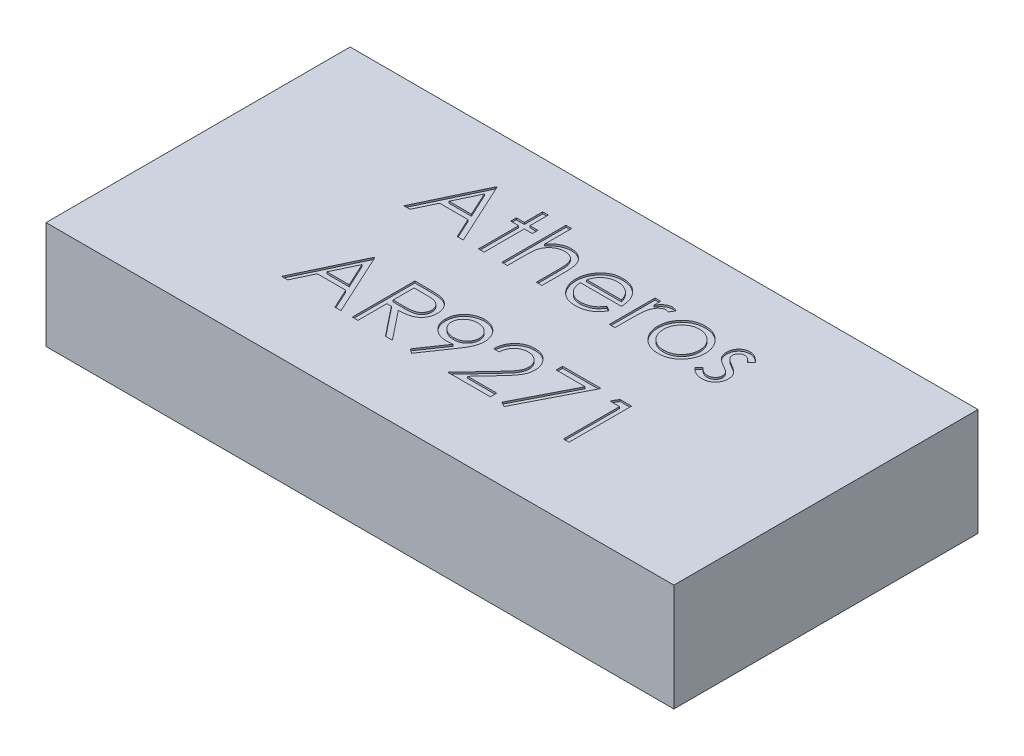
from build123d import *

# Parameters (mm, degrees)
SKETCH1_W           = 35.1
SKETCH1_H           = 17
BOSS_EXTRUDE1_DEPTH = 6
CUT_EXTRUDE1_DEPTH  = 0.1


with BuildPart() as part:
    # Sketch1 → Boss-Extrude1 (new body)
    with BuildSketch(Plane(origin=(0, 0, 0), x_dir=(1, 0, 0), z_dir=(0, 1, 0))):
        with Locations((17.55, 8.5)):
            Rectangle(SKETCH1_W, SKETCH1_H)
    extrude(amount=BOSS_EXTRUDE1_DEPTH)

    # Sketch2 → Cut-Extrude1 (cut)
    # profile 1 of 13: a face of its own
    with BuildSketch(Plane(origin=(0, 6, 0), x_dir=(1, 0, 0), z_dir=(0, 1, 0))):
        Polygon((10.894419489, 14.316811655), (12.509804105, 10.816811655), (12.168357791, 10.816811655), (11.650929906, 11.938606527), (10.064291284, 11.938606527), (9.532139842, 10.816811655), (9.189291284, 10.816811655), (10.849547694, 14.316811655), align=None)
        Polygon((10.868477983, 13.634620149), (10.23466388, 12.297580886), (11.485465162, 12.297580886), align=None, mode=Mode.SUBTRACT)
    # profile 2 of 13: a face of its own
    with BuildSketch(Plane(origin=(0, 6, 0), x_dir=(1, 0, 0), z_dir=(0, 1, 0))):
        Polygon((13.362368207, 14.406555245), (13.676470771, 14.406555245), (13.676470771, 13.374503963), (14.12518872, 13.374503963), (14.12518872, 13.060401399), (13.676470771, 13.060401399), (13.676470771, 10.816811655), (13.362368207, 10.816811655), (13.362368207, 13.060401399), (12.913650258, 13.060401399), (12.913650258, 13.374503963), (13.362368207, 13.374503963), align=None)
    # profile 3 of 13: a face of its own
    with BuildSketch(Plane(origin=(0, 6, 0), x_dir=(1, 0, 0), z_dir=(0, 1, 0))):
        with BuildLine():
            Line((14.663650258, 14.406555245), (14.977752823, 14.406555245))
            Line((14.977752823, 14.406555245), (14.977752823, 12.891431046))
            add(Edge.make_bspline(
                [(14.977752823, 12.891431046), (15.011470124, 12.933575028), (15.077119438, 13.015631521), (15.187615555, 13.122692712), (15.301086427, 13.215491333), (15.421451237, 13.28936179), (15.546501757, 13.347718333), (15.676765402, 13.38910598), (15.812266373, 13.414557076), (15.904291523, 13.417755494), (15.950909874, 13.419375757)],
                knots=[0, 0, 0, 0, 1.125788106, 2.19196713, 3.20547328, 4.180437432, 5.132270164, 6.079753143, 7.027236121, 8, 8, 8, 8], degree=3))
            add(Edge.make_bspline(
                [(15.950909874, 13.419375757), (15.998240267, 13.417630327), (16.090877262, 13.414214099), (16.225758725, 13.387200718), (16.3517196, 13.34104328), (16.468385443, 13.277876255), (16.57321014, 13.199203428), (16.666059904, 13.108371905), (16.741900703, 13.003097987), (16.79349982, 12.905841733), (16.827073228, 12.819302979), (16.848325054, 12.745066467), (16.866344252, 12.662344554), (16.882043988, 12.571179821), (16.89250757, 12.47113465), (16.900912188, 12.362660395), (16.906888642, 12.245763277), (16.907120246, 12.164843028), (16.907240002, 12.123001559)],
                knots=[0, 0, 0, 0, 1.235656852, 2.418478516, 3.575258207, 4.727955599, 5.870717718, 6.98870536, 8.107142894, 9.245821548, 9.854588956, 10.528768408, 11.260415777, 12.065282286, 12.943670737, 13.886611085, 14.907229059, 16, 16, 16, 16], degree=3))
            Line((16.907240002, 12.123001559), (16.907240002, 10.816811655))
            Line((16.907240002, 10.816811655), (16.593137438, 10.816811655))
            Line((16.593137438, 10.816811655), (16.593137438, 12.019936655))
            add(Edge.make_bspline(
                [(16.593137438, 12.019936655), (16.592947135, 12.054759324), (16.592583117, 12.121369165), (16.591379773, 12.216735273), (16.588693557, 12.303231408), (16.584352732, 12.38058036), (16.579787424, 12.448889963), (16.573504107, 12.508061017), (16.566193873, 12.558174793), (16.559625091, 12.588339421), (16.556679105, 12.601867745)],
                knots=[0, 0, 0, 0, 1.430932559, 2.737130458, 3.918967929, 4.986496826, 5.920444988, 6.731744033, 7.431208747, 8, 8, 8, 8], degree=3))
            add(Edge.make_bspline(
                [(16.556679105, 12.601867745), (16.54525486, 12.641562008), (16.523291815, 12.717873999), (16.472243838, 12.821536409), (16.408484827, 12.90992115), (16.330637565, 12.981835438), (16.240079201, 13.038246977), (16.136219237, 13.07731476), (16.020035168, 13.101562481), (15.938183697, 13.104001785), (15.895521252, 13.105273193)],
                knots=[0, 0, 0, 0, 1.090059168, 2.095632401, 3.037101401, 3.955032261, 4.878929692, 5.839099886, 6.873700383, 8, 8, 8, 8], degree=3))
            add(Edge.make_bspline(
                [(15.895521252, 13.105273193), (15.870253479, 13.104797367), (15.820249209, 13.103855719), (15.746100543, 13.094401821), (15.674171479, 13.078953102), (15.603769301, 13.058048563), (15.536386104, 13.029603027), (15.470057779, 12.996672837), (15.40666357, 12.956364582), (15.345077753, 12.911138815), (15.28776022, 12.861069055), (15.234433104, 12.8082221), (15.186894764, 12.751947136), (15.143826173, 12.69314702), (15.106647887, 12.631015227), (15.074194805, 12.566150908), (15.046659109, 12.498468762), (15.032976417, 12.451493701), (15.026130226, 12.42798954)],
                knots=[0, 0, 0, 0, 1.024319606, 2.027102035, 3.025350316, 4.005802111, 5.00026367, 5.987881639, 7.005602596, 8.042517216, 9.083927026, 10.089214625, 11.084353441, 12.06828073, 13.041928858, 14.016821737, 15.00770877, 16, 16, 16, 16], degree=3))
            add(Edge.make_bspline(
                [(15.026130226, 12.42798954), (15.022190799, 12.410968589), (15.013606302, 12.373877842), (15.004291469, 12.312703518), (14.995953672, 12.241617146), (14.988905123, 12.160726545), (14.984582036, 12.069735303), (14.979923796, 11.969264344), (14.978189782, 11.858684323), (14.977902829, 11.781788816), (14.977752823, 11.741591302)],
                knots=[0, 0, 0, 0, 0.607992626, 1.324890765, 2.152360218, 3.099583803, 4.150613268, 5.323148443, 6.60066238, 8, 8, 8, 8], degree=3))
            Line((14.977752823, 11.741591302), (14.977752823, 10.816811655))
            Line((14.977752823, 10.816811655), (14.663650258, 10.816811655))
            Line((14.663650258, 10.816811655), (14.663650258, 14.406555245))
        make_face()
    # profile 4 of 13: a face of its own
    with BuildSketch(Plane(origin=(0, 6, 0), x_dir=(1, 0, 0), z_dir=(0, 1, 0))):
        with BuildLine():
            Line((19.724347374, 11.624503963), (20.003393848, 11.477969507))
            add(Edge.make_bspline(
                [(20.003393848, 11.477969507), (19.981157253, 11.438526176), (19.937893645, 11.361785073), (19.863492897, 11.256353213), (19.785500824, 11.161505497), (19.700396856, 11.079775843), (19.610727177, 11.008524458), (19.515994522, 10.946186633), (19.415705705, 10.893068113), (19.30985598, 10.848315585), (19.197556429, 10.813906091), (19.078534912, 10.78960187), (18.952563417, 10.774578601), (18.866217237, 10.77283346), (18.822003624, 10.77193986)],
                knots=[0, 0, 0, 0, 1.120438281, 2.179929193, 3.190490725, 4.156257408, 5.095198341, 6.022838206, 6.959905092, 7.901321166, 8.864066838, 9.862729781, 10.905609505, 12, 12, 12, 12], degree=3))
            add(Edge.make_bspline(
                [(18.822003624, 10.77193986), (18.772861646, 10.773087035), (18.676999885, 10.775324842), (18.537460138, 10.794617307), (18.406080719, 10.826089665), (18.282869016, 10.870055207), (18.168126763, 10.927482531), (18.061625908, 10.997442013), (17.962806383, 11.079574267), (17.874782173, 11.174590711), (17.795538291, 11.276272668), (17.725612471, 11.382228553), (17.66715504, 11.492191777), (17.619602429, 11.605462301), (17.581197564, 11.721326195), (17.554430861, 11.840837662), (17.539001113, 11.963673246), (17.536636667, 12.046770582), (17.53544513, 12.088646591)],
                knots=[0, 0, 0, 0, 1.145258523, 2.234067595, 3.276747158, 4.290159414, 5.277019952, 6.260822364, 7.254936242, 8.264827045, 9.274100331, 10.257902744, 11.220704747, 12.172965371, 13.118907548, 14.062713208, 15.023725156, 16, 16, 16, 16], degree=3))
            add(Edge.make_bspline(
                [(17.53544513, 12.088646591), (17.536504272, 12.127941421), (17.53860335, 12.205818586), (17.551834137, 12.32108413), (17.57528243, 12.433112583), (17.607458754, 12.541997031), (17.64901, 12.647555165), (17.69984222, 12.749851229), (17.760034597, 12.848776368), (17.806507271, 12.911179502), (17.829916284, 12.942612937)],
                knots=[0, 0, 0, 0, 1.024358464, 2.0301432, 3.019427413, 4.004406732, 4.986367066, 5.972626655, 6.978780325, 8, 8, 8, 8], degree=3))
            add(Edge.make_bspline(
                [(17.829916284, 12.942612937), (17.861623967, 12.980481807), (17.924034914, 13.055019958), (18.029591269, 13.152958283), (18.143891465, 13.235002058), (18.265503091, 13.303009195), (18.395839565, 13.354682842), (18.533148856, 13.393190424), (18.678994443, 13.414768435), (18.778699663, 13.417816269), (18.829715964, 13.419375757)],
                knots=[0, 0, 0, 0, 1.030682036, 2.02871468, 2.997146059, 3.962720338, 4.930598197, 5.918074684, 6.934738563, 8, 8, 8, 8], degree=3))
            add(Edge.make_bspline(
                [(18.829715964, 13.419375757), (18.882163569, 13.418021709), (18.985053815, 13.415365373), (19.135085936, 13.39073904), (19.277046652, 13.351686485), (19.410879157, 13.296532695), (19.536597017, 13.225373143), (19.653383067, 13.137231302), (19.76323458, 13.034813214), (19.827143158, 12.956050005), (19.85966388, 12.915970309)],
                knots=[0, 0, 0, 0, 1.056321875, 2.072262726, 3.055038591, 4.01806755, 4.982017516, 5.957941055, 6.960871419, 8, 8, 8, 8], degree=3))
            add(Edge.make_bspline(
                [(19.85966388, 12.915970309), (19.881790819, 12.885766727), (19.925897412, 12.825560609), (19.981144512, 12.727389452), (20.029101907, 12.624678857), (20.067434868, 12.51576856), (20.098474369, 12.40194898), (20.120931188, 12.282406435), (20.134100806, 12.157176524), (20.136689504, 12.071849968), (20.138009233, 12.028350116)],
                knots=[0, 0, 0, 0, 0.94817472, 1.890038105, 2.849395472, 3.817997239, 4.812318967, 5.836947057, 6.897266129, 8, 8, 8, 8], degree=3))
            Line((20.138009233, 12.028350116), (17.849547694, 12.028350116))
            add(Edge.make_bspline(
                [(17.849547694, 12.028350116), (17.851087301, 11.994649652), (17.854114875, 11.928379048), (17.868230018, 11.831408265), (17.890478792, 11.739034923), (17.921747854, 11.651951881), (17.9596147, 11.569021754), (18.006000416, 11.490859717), (18.06133997, 11.417821787), (18.12306567, 11.349254649), (18.191772765, 11.288193888), (18.264055512, 11.233542112), (18.340949077, 11.187736515), (18.421847161, 11.150556625), (18.506618946, 11.121450309), (18.595291141, 11.101582489), (18.687689257, 11.088275382), (18.750674991, 11.086795716), (18.782740803, 11.086042424)],
                knots=[0, 0, 0, 0, 1.094153842, 2.151609401, 3.174256925, 4.172055639, 5.149267565, 6.128595816, 7.11444997, 8.118368179, 9.117203808, 10.09244225, 11.054858984, 12.015122123, 12.976791628, 13.957293641, 14.960065497, 16, 16, 16, 16], degree=3))
            add(Edge.make_bspline(
                [(18.782740803, 11.086042424), (18.814091951, 11.086650481), (18.876298642, 11.087856982), (18.968939499, 11.099588893), (19.060079027, 11.118559168), (19.14934001, 11.144449158), (19.234910856, 11.176026011), (19.314156406, 11.214128868), (19.387036621, 11.256278615), (19.455153588, 11.30448829), (19.521224581, 11.363496477), (19.586767068, 11.437132198), (19.657043721, 11.524219726), (19.701033314, 11.589765392), (19.724347374, 11.624503963)],
                knots=[0, 0, 0, 0, 0.99110716, 1.966546729, 2.947904876, 3.932708344, 4.903319531, 5.828989031, 6.710028674, 7.56322171, 8.463672341, 9.504779593, 10.677557249, 12, 12, 12, 12], degree=3))
        make_face()
        with BuildLine():
            add(Edge.make_bspline(
                [(19.823906669, 12.342452681), (19.812410044, 12.384115554), (19.790282743, 12.464303175), (19.744046378, 12.575344065), (19.691974838, 12.674031966), (19.630353106, 12.759611599), (19.560534381, 12.835615112), (19.479889198, 12.902033698), (19.389453304, 12.961451149), (19.289694164, 13.011603648), (19.184052379, 13.054293507), (19.073446187, 13.082918623), (18.960588399, 13.102528165), (18.884254112, 13.104354273), (18.845841765, 13.105273193)],
                knots=[0, 0, 0, 0, 1.154881502, 2.222775134, 3.210006277, 4.132804581, 5.035138423, 5.962687519, 6.919655026, 7.923214229, 8.944639381, 9.960483929, 10.97369054, 12, 12, 12, 12], degree=3))
            add(Edge.make_bspline(
                [(18.845841765, 13.105273193), (18.814492326, 13.104661522), (18.752521077, 13.103452376), (18.661220009, 13.091982246), (18.57354031, 13.073022402), (18.488835023, 13.047057445), (18.408214154, 13.012448842), (18.330019386, 12.971865616), (18.25623899, 12.922324032), (18.210097694, 12.884565177), (18.186787278, 12.86548954)],
                knots=[0, 0, 0, 0, 1.04873581, 2.073130211, 3.073294108, 4.04793562, 5.032784715, 6.005352987, 6.992311501, 8, 8, 8, 8], degree=3))
            add(Edge.make_bspline(
                [(18.186787278, 12.86548954), (18.170093996, 12.850395224), (18.136310862, 12.819848008), (18.09117034, 12.767218801), (18.047949867, 12.710467239), (18.008616215, 12.647422115), (17.972538628, 12.578801336), (17.938778651, 12.5051837), (17.908392239, 12.42601057), (17.891296129, 12.370838131), (17.882500419, 12.342452681)],
                knots=[0, 0, 0, 0, 0.879870761, 1.780643979, 2.707998968, 3.669668524, 4.684282772, 5.740141944, 6.837334558, 8, 8, 8, 8], degree=3))
            Line((17.882500419, 12.342452681), (19.823906669, 12.342452681))
        make_face(mode=Mode.SUBTRACT)
    # profile 5 of 13: a face of its own
    with BuildSketch(Plane(origin=(0, 6, 0), x_dir=(1, 0, 0), z_dir=(0, 1, 0))):
        with BuildLine():
            Line((20.676470771, 13.374503963), (20.990573335, 13.374503963))
            Line((20.990573335, 13.374503963), (20.990573335, 12.998001559))
            add(Edge.make_bspline(
                [(20.990573335, 12.998001559), (21.013762094, 13.033057387), (21.058110415, 13.100101386), (21.131823344, 13.188770687), (21.207326676, 13.262185734), (21.284981863, 13.320689253), (21.365359963, 13.364502372), (21.446696915, 13.396595407), (21.530272385, 13.415572722), (21.586434309, 13.418106381), (21.614571733, 13.419375757)],
                knots=[0, 0, 0, 0, 1.2804753, 2.448899062, 3.506932113, 4.484331642, 5.4025378, 6.288909075, 7.142734305, 8, 8, 8, 8], degree=3))
            add(Edge.make_bspline(
                [(21.614571733, 13.419375757), (21.636398059, 13.418185231), (21.681307145, 13.415735645), (21.749289734, 13.39852482), (21.819333186, 13.371046798), (21.864475573, 13.345206575), (21.888009233, 13.331735533)],
                knots=[0, 0, 0, 0, 0.901110191, 1.854092781, 2.881294221, 4, 4, 4, 4], degree=3))
            Line((21.888009233, 13.331735533), (21.715533271, 13.059700277))
            add(Edge.make_bspline(
                [(21.715533271, 13.059700277), (21.70042425, 13.066440543), (21.671744436, 13.079234858), (21.629789869, 13.094376868), (21.591108533, 13.103292784), (21.566464974, 13.104643502), (21.55497638, 13.105273193)],
                knots=[0, 0, 0, 0, 1.180555205, 2.24091978, 3.179933427, 4, 4, 4, 4], degree=3))
            add(Edge.make_bspline(
                [(21.55497638, 13.105273193), (21.529770647, 13.103593156), (21.478358257, 13.100166367), (21.402873757, 13.073227559), (21.329626552, 13.029702319), (21.27145489, 12.981431207), (21.226412637, 12.93488341), (21.194272411, 12.894235007), (21.164789664, 12.848656375), (21.136619444, 12.798926692), (21.11095315, 12.744196846), (21.08699848, 12.685013632), (21.065339617, 12.621308503), (21.052989373, 12.576925983), (21.046663079, 12.554191463)],
                knots=[0, 0, 0, 0, 1.125678352, 2.296057538, 3.5422874, 4.923748041, 5.663163013, 6.437101912, 7.23742474, 8.08941207, 8.991984279, 9.93940061, 10.944477711, 12, 12, 12, 12], degree=3))
            add(Edge.make_bspline(
                [(21.046663079, 12.554191463), (21.041930686, 12.533914289), (21.031448794, 12.48900189), (21.021257256, 12.413653366), (21.011187738, 12.324629707), (21.00409112, 12.221683114), (20.997513078, 12.10507067), (20.993802995, 11.974614724), (20.990699855, 11.830181373), (20.990616788, 11.72920702), (20.990573335, 11.676386975)],
                knots=[0, 0, 0, 0, 0.566838948, 1.255505196, 2.06880316, 3.007127437, 4.065329342, 5.249902469, 6.561414163, 8, 8, 8, 8], degree=3))
            Line((20.990573335, 11.676386975), (20.990573335, 10.816811655))
            Line((20.990573335, 10.816811655), (20.676470771, 10.816811655))
            Line((20.676470771, 10.816811655), (20.676470771, 13.374503963))
        make_face()
    # profile 6 of 13: a face of its own
    with BuildSketch(Plane(origin=(0, 6, 0), x_dir=(1, 0, 0), z_dir=(0, 1, 0))):
        with BuildLine():
            add(Edge.make_bspline(
                [(23.4374884, 13.419375757), (23.485479672, 13.418353866), (23.57957883, 13.416350188), (23.717386716, 13.394935222), (23.848931852, 13.362187858), (23.974718044, 13.316916295), (24.093134339, 13.256234345), (24.205905583, 13.183825054), (24.312722592, 13.09804246), (24.376745622, 13.031684392), (24.409243207, 12.998001559)],
                knots=[0, 0, 0, 0, 1.054011418, 2.066658804, 3.057071809, 4.030435133, 4.997543892, 5.974964718, 6.972108034, 8, 8, 8, 8], degree=3))
            add(Edge.make_bspline(
                [(24.409243207, 12.998001559), (24.437225161, 12.965787573), (24.492647542, 12.901983031), (24.56371326, 12.798527418), (24.62493482, 12.691387317), (24.673997781, 12.579139991), (24.712682805, 12.462765319), (24.740148501, 12.341863308), (24.756485436, 12.216700961), (24.758688403, 12.131697123), (24.759804105, 12.088646591)],
                knots=[0, 0, 0, 0, 1.025258237, 2.030674902, 3.01204498, 3.988269485, 4.97094183, 5.956517959, 6.965070386, 8, 8, 8, 8], degree=3))
            add(Edge.make_bspline(
                [(24.759804105, 12.088646591), (24.758822767, 12.045346533), (24.756883599, 11.9597836), (24.738539983, 11.833764234), (24.710008897, 11.711569411), (24.669177059, 11.593710718), (24.616818949, 11.47982789), (24.552928262, 11.370418341), (24.477056645, 11.265266208), (24.391052648, 11.165264369), (24.296000772, 11.073098155), (24.192884623, 10.992769885), (24.08373059, 10.923948361), (23.967087236, 10.868511945), (23.84401975, 10.824802245), (23.714262681, 10.794102228), (23.578017611, 10.775540545), (23.48499039, 10.773156971), (23.4374884, 10.77193986)],
                knots=[0, 0, 0, 0, 0.998656419, 1.973391657, 2.932242238, 3.890759089, 4.846373663, 5.82037756, 6.809684879, 7.83454468, 8.860553229, 9.859544525, 10.845671541, 11.83227036, 12.833544569, 13.85385346, 14.904124723, 16, 16, 16, 16], degree=3))
            add(Edge.make_bspline(
                [(23.4374884, 10.77193986), (23.38975368, 10.773161056), (23.29626282, 10.775552831), (23.159536838, 10.794030113), (23.029547219, 10.824788096), (22.906318621, 10.868655589), (22.789173774, 10.923950133), (22.679387277, 10.992561822), (22.576187361, 11.073121977), (22.481115377, 11.165257914), (22.395116772, 11.265267871), (22.319243763, 11.370417909), (22.255353437, 11.479828003), (22.202995233, 11.593710688), (22.16216342, 11.711569419), (22.133632328, 11.833764232), (22.115288713, 11.9597836), (22.113349545, 12.045346533), (22.112368207, 12.088646591)],
                knots=[0, 0, 0, 0, 1.099876186, 2.154163076, 3.173186993, 4.173200201, 5.163417411, 6.152872554, 7.150605724, 8.17532212, 9.198891216, 10.186952605, 11.159729845, 12.11414092, 13.071450619, 14.029093627, 15.002601286, 16, 16, 16, 16], degree=3))
            add(Edge.make_bspline(
                [(22.112368207, 12.088646591), (22.113491518, 12.131463137), (22.115715479, 12.216232539), (22.132035988, 12.3411596), (22.159394545, 12.461856989), (22.198125941, 12.577782465), (22.247641132, 12.689537901), (22.30800242, 12.796942732), (22.379793052, 12.899930532), (22.434995004, 12.963652612), (22.462929105, 12.995898193)],
                knots=[0, 0, 0, 0, 1.031353054, 2.041901799, 3.029428768, 4.008703097, 4.981709435, 5.96992636, 6.972712378, 8, 8, 8, 8], degree=3))
            add(Edge.make_bspline(
                [(22.462929105, 12.995898193), (22.495377696, 13.029873133), (22.55919356, 13.096690829), (22.666542287, 13.182223353), (22.779036108, 13.256139427), (22.898761034, 13.315615642), (23.024443892, 13.36245416), (23.156663135, 13.395019675), (23.29493865, 13.41627303), (23.389498272, 13.418331208), (23.4374884, 13.419375757)],
                knots=[0, 0, 0, 0, 1.027980169, 2.021703884, 2.998553061, 3.971491411, 4.943284454, 5.930300938, 6.949603206, 8, 8, 8, 8], degree=3))
        make_face()
        with BuildLine():
            add(Edge.make_bspline(
                [(23.436086156, 13.105273193), (23.402148545, 13.104308602), (23.335149416, 13.102404319), (23.236529831, 13.087920414), (23.141589677, 13.06497291), (23.050148833, 13.032368854), (22.962515661, 12.990269955), (22.878606258, 12.938561595), (22.798173818, 12.877928639), (22.722791755, 12.808465967), (22.653609443, 12.732586972), (22.593131466, 12.651738613), (22.54170636, 12.567232267), (22.498866201, 12.478980056), (22.466959013, 12.386087642), (22.44378599, 12.289607011), (22.42931575, 12.189341594), (22.427429371, 12.121180576), (22.426470771, 12.086543225)],
                knots=[0, 0, 0, 0, 1.021534396, 2.016698045, 2.994645724, 3.958388632, 4.93408049, 5.916473867, 6.921342795, 7.962252576, 8.998418191, 10.008913653, 10.997312074, 11.973003931, 12.956656626, 13.948281152, 14.957379055, 16, 16, 16, 16], degree=3))
            add(Edge.make_bspline(
                [(22.426470771, 12.086543225), (22.428077595, 12.041791198), (22.431266839, 11.952966793), (22.457202076, 11.82215567), (22.500588356, 11.696573818), (22.559175635, 11.576957432), (22.632581854, 11.466285154), (22.719068921, 11.36761367), (22.817708621, 11.282427858), (22.927325121, 11.211747013), (23.045679439, 11.155587257), (23.17093576, 11.115788281), (23.301576454, 11.089916589), (23.390857186, 11.087345114), (23.436086156, 11.086042424)],
                knots=[0, 0, 0, 0, 1.016792936, 2.018143844, 3.017858371, 4.030088057, 5.03801393, 6.028138512, 7.003788237, 7.991172063, 8.984598303, 9.972568034, 10.972917682, 12, 12, 12, 12], degree=3))
            add(Edge.make_bspline(
                [(23.436086156, 11.086042424), (23.481312525, 11.087352704), (23.570588121, 11.089939161), (23.701047298, 11.115657981), (23.82596127, 11.155761642), (23.944192657, 11.211683852), (24.05375926, 11.282696266), (24.153108382, 11.367132643), (24.238856993, 11.466546495), (24.312190598, 11.577104024), (24.371737341, 11.696388376), (24.414920542, 11.822178848), (24.440918128, 11.95296089), (24.444098957, 12.041789221), (24.445701541, 12.086543225)],
                knots=[0, 0, 0, 0, 1.02726834, 2.027799167, 3.010890988, 4.004497153, 4.992059811, 5.971914811, 6.958719428, 7.966827853, 8.981595046, 9.981490638, 10.983022906, 12, 12, 12, 12], degree=3))
            add(Edge.make_bspline(
                [(24.445701541, 12.086543225), (24.444743271, 12.121180783), (24.442857541, 12.189342209), (24.428382577, 12.289604662), (24.405227037, 12.386096259), (24.37325542, 12.478948262), (24.330601406, 12.567460767), (24.278184613, 12.651490494), (24.217953588, 12.73286704), (24.147936467, 12.808220681), (24.072633089, 12.877955717), (23.992168051, 12.938585107), (23.908383072, 12.990042702), (23.82100449, 13.032728943), (23.729551922, 13.064676283), (23.634744793, 13.088052914), (23.536545983, 13.102343111), (23.46978694, 13.104290253), (23.436086156, 13.105273193)],
                knots=[0, 0, 0, 0, 1.042956736, 2.052379634, 3.044323526, 4.02829302, 5.004299113, 5.996692471, 7.007513377, 8.048758398, 9.090003419, 10.095195979, 11.07790575, 12.047570684, 13.018257071, 13.989683339, 14.985167495, 16, 16, 16, 16], degree=3))
        make_face(mode=Mode.SUBTRACT)
    # profile 7 of 13: a face of its own
    with BuildSketch(Plane(origin=(0, 6, 0), x_dir=(1, 0, 0), z_dir=(0, 1, 0))):
        with BuildLine():
            Line((26.599547694, 13.055493546), (26.386406669, 12.836042424))
            add(Edge.make_bspline(
                [(26.386406669, 12.836042424), (26.368016165, 12.85735557), (26.332561439, 12.898444808), (26.276329958, 12.953381874), (26.220306355, 12.999518813), (26.165257541, 13.038471072), (26.109799272, 13.067920219), (26.054582354, 13.08941508), (25.999549616, 13.102716886), (25.96276358, 13.104431325), (25.944699938, 13.105273193)],
                knots=[0, 0, 0, 0, 1.26578478, 2.440284043, 3.530471711, 4.527705817, 5.468200915, 6.346673037, 7.188140097, 8, 8, 8, 8], degree=3))
            add(Edge.make_bspline(
                [(25.944699938, 13.105273193), (25.922560548, 13.10419832), (25.878993362, 13.102083123), (25.816567544, 13.080969692), (25.758616919, 13.048560954), (25.708459939, 13.00259237), (25.665972259, 12.949828101), (25.634958578, 12.890831776), (25.615992594, 12.827383733), (25.613587862, 12.783353875), (25.612368207, 12.761022392)],
                knots=[0, 0, 0, 0, 0.99966794, 1.967205029, 2.953328237, 3.988086729, 5.028030931, 6.008226631, 6.989793394, 8, 8, 8, 8], degree=3))
            add(Edge.make_bspline(
                [(25.612368207, 12.761022392), (25.613479019, 12.740810348), (25.615697513, 12.700443237), (25.632944192, 12.640895203), (25.660410264, 12.582838165), (25.686080458, 12.547275259), (25.69930731, 12.528951078)],
                knots=[0, 0, 0, 0, 0.960159726, 1.917612774, 2.927026955, 4, 4, 4, 4], degree=3))
            add(Edge.make_bspline(
                [(25.69930731, 12.528951078), (25.707270804, 12.519166494), (25.724220096, 12.498341239), (25.756028611, 12.469437386), (25.792051114, 12.437495135), (25.835371052, 12.405558298), (25.88412208, 12.371926573), (25.939361364, 12.33792444), (25.999335869, 12.300960015), (26.042273176, 12.277515579), (26.064591765, 12.265329283)],
                knots=[0, 0, 0, 0, 0.66740084, 1.420478572, 2.27185888, 3.217733974, 4.268547843, 5.408967954, 6.65319498, 8, 8, 8, 8], degree=3))
            add(Edge.make_bspline(
                [(26.064591765, 12.265329283), (26.091805342, 12.25008438), (26.144373012, 12.220636248), (26.219065779, 12.174926544), (26.28685282, 12.12949512), (26.348308488, 12.084827846), (26.402250297, 12.039674979), (26.450314849, 11.995767222), (26.491303293, 11.951777913), (26.51425722, 11.9210448), (26.525228784, 11.906354924)],
                knots=[0, 0, 0, 0, 1.27191281, 2.456916733, 3.569705269, 4.599008579, 5.553216877, 6.436649441, 7.252746552, 8, 8, 8, 8], degree=3))
            add(Edge.make_bspline(
                [(26.525228784, 11.906354924), (26.543439312, 11.876688836), (26.579681641, 11.817647815), (26.617739907, 11.720429388), (26.639800182, 11.617318885), (26.642862402, 11.546786665), (26.644419489, 11.510922232)],
                knots=[0, 0, 0, 0, 0.995354457, 1.980940102, 2.973342416, 4, 4, 4, 4], degree=3))
            add(Edge.make_bspline(
                [(26.644419489, 11.510922232), (26.643699955, 11.485653086), (26.642282035, 11.435857472), (26.632423969, 11.362522643), (26.615468992, 11.292388085), (26.592375238, 11.224692801), (26.561190865, 11.160733861), (26.524643068, 11.098897612), (26.480768156, 11.040521681), (26.430676781, 10.985682721), (26.375831287, 10.935596974), (26.317325148, 10.89157302), (26.255086318, 10.854998683), (26.189559516, 10.824733337), (26.120595862, 10.800665079), (26.048184573, 10.784002548), (25.972555819, 10.774029787), (25.92112601, 10.772645311), (25.894920291, 10.77193986)],
                knots=[0, 0, 0, 0, 1.032770009, 2.035186124, 3.017557409, 3.978232242, 4.952395191, 5.920591857, 6.910227898, 7.931268572, 8.952309245, 9.941945286, 10.918353717, 11.897095711, 12.887975737, 13.898235213, 14.929059601, 16, 16, 16, 16], degree=3))
            add(Edge.make_bspline(
                [(25.894920291, 10.77193986), (25.859553115, 10.77293256), (25.789310188, 10.774904168), (25.685420469, 10.793410229), (25.58389971, 10.822205623), (25.48551617, 10.861921557), (25.392470056, 10.91207227), (25.307339132, 10.972134663), (25.229827669, 11.040124661), (25.185709395, 11.092237571), (25.163650258, 11.118294027)],
                knots=[0, 0, 0, 0, 1.013940152, 2.01379169, 3.017749504, 4.037548394, 5.051665909, 6.043208538, 7.021604269, 8, 8, 8, 8], degree=3))
            Line((25.163650258, 11.118294027), (25.371883432, 11.355273193))
            add(Edge.make_bspline(
                [(25.371883432, 11.355273193), (25.391655845, 11.333918429), (25.429987657, 11.292518989), (25.491288874, 11.237394648), (25.553668275, 11.191193377), (25.616502961, 11.152549962), (25.680723056, 11.122774559), (25.74596867, 11.101855965), (25.812107094, 11.088411773), (25.85652923, 11.086833491), (25.878794489, 11.086042424)],
                knots=[0, 0, 0, 0, 1.179806542, 2.287233372, 3.337373186, 4.324005949, 5.273901747, 6.200048787, 7.097828587, 8, 8, 8, 8], degree=3))
            add(Edge.make_bspline(
                [(25.878794489, 11.086042424), (25.909112415, 11.087413249), (25.968348557, 11.090091611), (26.053192315, 11.114408703), (26.131530942, 11.152538655), (26.199554287, 11.206623353), (26.257456448, 11.269578925), (26.299384623, 11.340493045), (26.325660798, 11.417284501), (26.328746797, 11.470516804), (26.330316925, 11.497600918)],
                knots=[0, 0, 0, 0, 1.072336372, 2.095165389, 3.102688358, 4.141489647, 5.156069229, 6.117746104, 7.042326257, 8, 8, 8, 8], degree=3))
            add(Edge.make_bspline(
                [(26.330316925, 11.497600918), (26.329230631, 11.519910536), (26.327085888, 11.563957892), (26.310242616, 11.627708233), (26.283629764, 11.688177514), (26.257425115, 11.723567161), (26.244078944, 11.741591302)],
                knots=[0, 0, 0, 0, 1.013901739, 2.00181326, 2.98231254, 4, 4, 4, 4], degree=3))
            add(Edge.make_bspline(
                [(26.244078944, 11.741591302), (26.23605655, 11.750626665), (26.218580877, 11.770308947), (26.186525636, 11.798734025), (26.148143774, 11.829372125), (26.103003611, 11.861703713), (26.051014149, 11.895302319), (25.991964674, 11.929991671), (25.926664121, 11.967419397), (25.88049349, 11.992239052), (25.856358592, 12.005213097)],
                knots=[0, 0, 0, 0, 0.615000592, 1.339693406, 2.178160186, 3.116406724, 4.166410947, 5.330106347, 6.604359322, 8, 8, 8, 8], degree=3))
            add(Edge.make_bspline(
                [(25.856358592, 12.005213097), (25.830311952, 12.019752229), (25.779799204, 12.047948245), (25.708251913, 12.091864325), (25.643704559, 12.1365316), (25.584603985, 12.179444439), (25.532442979, 12.222865383), (25.487427031, 12.266842635), (25.447783815, 12.309602621), (25.425836403, 12.339899917), (25.415352983, 12.354371751)],
                knots=[0, 0, 0, 0, 1.262093308, 2.447601706, 3.550203992, 4.582594899, 5.537233252, 6.418365656, 7.244515135, 8, 8, 8, 8], degree=3))
            add(Edge.make_bspline(
                [(25.415352983, 12.354371751), (25.397222383, 12.383517366), (25.360954848, 12.441818781), (25.325739657, 12.539129258), (25.301533628, 12.641574315), (25.299371238, 12.71226117), (25.298265643, 12.7484022)],
                knots=[0, 0, 0, 0, 0.985009483, 1.970363186, 2.962279964, 4, 4, 4, 4], degree=3))
            add(Edge.make_bspline(
                [(25.298265643, 12.7484022), (25.298799838, 12.772027598), (25.299845334, 12.818265849), (25.308189386, 12.886204669), (25.323381097, 12.950752823), (25.34243602, 13.012879686), (25.368919024, 13.07138178), (25.400564929, 13.127039251), (25.437752354, 13.179775169), (25.480595645, 13.228778301), (25.52770229, 13.273287627), (25.57859706, 13.312086255), (25.632135317, 13.34519261), (25.688543736, 13.372957771), (25.748364209, 13.393959153), (25.811178596, 13.408416538), (25.87685975, 13.418071741), (25.921760876, 13.418934825), (25.944699938, 13.419375757)],
                knots=[0, 0, 0, 0, 1.087655834, 2.128696564, 3.144119009, 4.137814668, 5.115653402, 6.093965665, 7.082169637, 8.081268856, 9.086088321, 10.061021666, 11.022561449, 11.980240094, 12.950172527, 13.934149372, 14.944599409, 16, 16, 16, 16], degree=3))
            add(Edge.make_bspline(
                [(25.944699938, 13.419375757), (25.971892001, 13.418271417), (26.026786223, 13.416042019), (26.109140849, 13.398336329), (26.191374191, 13.369203224), (26.273697541, 13.328966991), (26.355507831, 13.276900115), (26.437524687, 13.213970816), (26.520732718, 13.140593101), (26.572689031, 13.084493876), (26.599547694, 13.055493546)],
                knots=[0, 0, 0, 0, 0.845714091, 1.707292901, 2.609013841, 3.555613372, 4.552488639, 5.621697636, 6.770543573, 8, 8, 8, 8], degree=3))
        make_face()
    # profile 8 of 13: a face of its own
    with BuildSketch(Plane(origin=(0, 6, 0), x_dir=(1, 0, 0), z_dir=(0, 1, 0))):
        Polygon((10.894419489, 7.483478322), (12.509804105, 3.983478322), (12.168357791, 3.983478322), (11.650929906, 5.105273193), (10.064291284, 5.105273193), (9.532139842, 3.983478322), (9.189291284, 3.983478322), (10.849547694, 7.483478322), align=None)
        Polygon((10.868477983, 6.801286815), (10.23466388, 5.464247552), (11.485465162, 5.464247552), align=None, mode=Mode.SUBTRACT)
    # profile 9 of 13: a face of its own
    with BuildSketch(Plane(origin=(0, 6, 0), x_dir=(1, 0, 0), z_dir=(0, 1, 0))):
        with BuildLine():
            Line((13.138009233, 7.483478322), (13.838429906, 7.483478322))
            add(Edge.make_bspline(
                [(13.838429906, 7.483478322), (13.885171034, 7.483322736), (13.974919179, 7.483023993), (14.103492449, 7.48135823), (14.220319546, 7.476583875), (14.325339386, 7.472475291), (14.41855004, 7.46498335), (14.500237331, 7.457822703), (14.570025029, 7.448449042), (14.61227088, 7.439743619), (14.631398656, 7.43580204)],
                knots=[0, 0, 0, 0, 1.410062039, 2.707475311, 3.878576406, 4.937260626, 5.877586885, 6.699081471, 7.410979367, 8, 8, 8, 8], degree=3))
            add(Edge.make_bspline(
                [(14.631398656, 7.43580204), (14.65700528, 7.429475274), (14.70767227, 7.416956711), (14.780622336, 7.39049711), (14.85013666, 7.359877485), (14.915926484, 7.323913765), (14.977662275, 7.282338985), (15.035980586, 7.235870863), (15.091146049, 7.184763657), (15.140927679, 7.127728815), (15.187866731, 7.067892306), (15.227455358, 7.003188549), (15.261581837, 6.935527021), (15.288752354, 6.864219604), (15.310630328, 6.789957832), (15.326056567, 6.712069035), (15.335307755, 6.63090806), (15.33624961, 6.575550151), (15.336727182, 6.547480725)],
                knots=[0, 0, 0, 0, 1.027469482, 2.033020251, 3.019912614, 3.986113645, 4.951240523, 5.91722682, 6.890402269, 7.87763091, 8.8651537, 9.85103654, 10.82876324, 11.815024772, 12.821070561, 13.842952187, 14.906261191, 16, 16, 16, 16], degree=3))
            add(Edge.make_bspline(
                [(15.336727182, 6.547480725), (15.335258183, 6.500845621), (15.332391788, 6.409848453), (15.305666684, 6.277787572), (15.261890164, 6.154598257), (15.201566875, 6.040435619), (15.1247474, 5.937524974), (15.032422608, 5.847134518), (14.924540997, 5.771494606), (14.824111681, 5.719041801), (14.735397481, 5.685448892), (14.662364169, 5.661812534), (14.582697191, 5.643550568), (14.497159856, 5.627190436), (14.405396201, 5.614838742), (14.307626162, 5.605792148), (14.20378001, 5.600138099), (14.132440941, 5.599296094), (14.095741605, 5.598862937)],
                knots=[0, 0, 0, 0, 1.260483769, 2.459530307, 3.627416485, 4.787058657, 5.939039949, 7.08810263, 8.267026773, 9.491475466, 10.141966685, 10.831826277, 11.566392101, 12.351337768, 13.187381173, 14.07005841, 15.007169909, 16, 16, 16, 16], degree=3))
            Line((14.095741605, 5.598862937), (15.381598976, 3.983478322))
            Line((15.381598976, 3.983478322), (14.993177502, 3.983478322))
            Line((14.993177502, 3.983478322), (13.70732013, 5.598862937))
            Line((13.70732013, 5.598862937), (13.452111797, 5.598862937))
            Line((13.452111797, 5.598862937), (13.452111797, 3.983478322))
            Line((13.452111797, 3.983478322), (13.138009233, 3.983478322))
            Line((13.138009233, 3.983478322), (13.138009233, 7.483478322))
        make_face()
        with BuildLine():
            Line((13.452111797, 7.124503963), (13.452111797, 5.957837296))
            Line((13.452111797, 5.957837296), (14.092937117, 5.952929443))
            add(Edge.make_bspline(
                [(14.092937117, 5.952929443), (14.122857156, 5.952916207), (14.180850713, 5.95289055), (14.264751378, 5.956884327), (14.34287149, 5.961427645), (14.414912242, 5.96837699), (14.480905817, 5.977333062), (14.540819231, 5.988536046), (14.594750283, 6.001588109), (14.657648821, 6.021789735), (14.727885352, 6.053795753), (14.804216812, 6.100361252), (14.86921915, 6.158930371), (14.924137012, 6.225903827), (14.968266444, 6.299540076), (14.999378498, 6.378956445), (15.01912094, 6.462148043), (15.021449486, 6.519326151), (15.022624617, 6.548181847)],
                knots=[0, 0, 0, 0, 1.146690395, 2.22261258, 3.21895312, 4.145990853, 4.996080663, 5.770904154, 6.481378293, 7.121626537, 8.300444488, 9.431385265, 10.535395872, 11.636531494, 12.74115979, 13.810798291, 14.895190096, 16, 16, 16, 16], degree=3))
            add(Edge.make_bspline(
                [(15.022624617, 6.548181847), (15.021422496, 6.576328421), (15.019040331, 6.63210466), (14.999591562, 6.71376057), (14.966702181, 6.79082752), (14.922379943, 6.862992005), (14.868380788, 6.928497741), (14.805062976, 6.984544894), (14.73415778, 7.030794359), (14.667886582, 7.060348739), (14.60865237, 7.078468592), (14.55722271, 7.091219756), (14.499111232, 7.101464225), (14.434035773, 7.109672286), (14.362274142, 7.11672723), (14.283463491, 7.121479009), (14.198126711, 7.124292873), (14.13897978, 7.124431962), (14.108361797, 7.124503963)],
                knots=[0, 0, 0, 0, 1.101028733, 2.181837193, 3.264309656, 4.369019818, 5.486613113, 6.575447106, 7.666700264, 8.788928104, 9.402425223, 10.0903467, 10.862060571, 11.710948788, 12.657782767, 13.684531032, 14.801375019, 16, 16, 16, 16], degree=3))
            Line((14.108361797, 7.124503963), (13.452111797, 7.124503963))
        make_face(mode=Mode.SUBTRACT)
    # profile 10 of 13: a face of its own
    with BuildSketch(Plane(origin=(0, 6, 0), x_dir=(1, 0, 0), z_dir=(0, 1, 0))):
        with BuildLine():
            Line((16.548265643, 3.893734732), (16.297264041, 4.068314059))
            Line((16.297264041, 4.068314059), (17.270421092, 5.490890181))
            add(Edge.make_bspline(
                [(17.270421092, 5.490890181), (17.208330356, 5.483297117), (17.086070236, 5.468345952), (16.962933134, 5.465599298), (16.90233215, 5.464247552)],
                knots=[0, 0, 0, 0, 1.015715272, 2, 2, 2, 2], degree=3))
            add(Edge.make_bspline(
                [(16.90233215, 5.464247552), (16.865590102, 5.465188629), (16.793468675, 5.46703588), (16.687437022, 5.481677688), (16.585551462, 5.504227816), (16.488082106, 5.537876571), (16.394662601, 5.57969478), (16.305496888, 5.631551793), (16.220704997, 5.692558085), (16.141197587, 5.762391077), (16.068885848, 5.839069129), (16.00446255, 5.920224772), (15.950921419, 6.006800743), (15.906444833, 6.097030962), (15.87271438, 6.192212313), (15.848151842, 6.291261713), (15.833029488, 6.394873355), (15.831230392, 6.465398486), (15.830316925, 6.501206687)],
                knots=[0, 0, 0, 0, 1.060718605, 2.082097864, 3.085795603, 4.069760067, 5.054557537, 6.03741023, 7.043284206, 8.066802108, 9.088538119, 10.083643548, 11.053783639, 12.022749082, 12.983451788, 13.964007469, 14.966251758, 16, 16, 16, 16], degree=3))
            add(Edge.make_bspline(
                [(15.830316925, 6.501206687), (15.83205136, 6.55017534), (15.835455704, 6.646290871), (15.862854221, 6.78672464), (15.90791456, 6.919511184), (15.970742937, 7.044301378), (16.049877658, 7.159300117), (16.144986248, 7.262908726), (16.255490213, 7.35365358), (16.378872232, 7.431657657), (16.512225253, 7.494392655), (16.651893911, 7.540631955), (16.796808031, 7.567830703), (16.894975701, 7.571416564), (16.944399457, 7.573221911)],
                knots=[0, 0, 0, 0, 1.022988612, 2.007919123, 2.978103895, 3.94594894, 4.918897164, 5.887013414, 6.875921846, 7.89917871, 8.930658928, 9.948724884, 10.967259574, 12, 12, 12, 12], degree=3))
            add(Edge.make_bspline(
                [(16.944399457, 7.573221911), (16.992887877, 7.571391748), (17.088696424, 7.567775519), (17.22958543, 7.54129155), (17.364526447, 7.496654877), (17.492771434, 7.434970313), (17.611510846, 7.357649405), (17.718286657, 7.265514882), (17.810662196, 7.158509354), (17.888486077, 7.039220864), (17.950956117, 6.911053883), (17.9960284, 6.777269961), (18.023774039, 6.638831239), (18.027270366, 6.545036765), (18.029034874, 6.497701078)],
                knots=[0, 0, 0, 0, 1.026385292, 2.028040595, 3.023318987, 4.028184125, 5.03290303, 6.015178782, 7.004435299, 8.016004309, 9.023023918, 10.015172535, 10.998308025, 12, 12, 12, 12], degree=3))
            add(Edge.make_bspline(
                [(18.029034874, 6.497701078), (18.027856465, 6.460957311), (18.025466357, 6.38643177), (18.00873005, 6.273201427), (17.980309865, 6.157750198), (17.948058166, 6.060028602), (17.916925999, 5.979320152), (17.887624867, 5.915568572), (17.855112713, 5.848467309), (17.817193948, 5.778719971), (17.776431651, 5.705437436), (17.730372375, 5.62935472), (17.680066803, 5.550369727), (17.644237083, 5.497122639), (17.625889842, 5.469856527)],
                knots=[0, 0, 0, 0, 1.179839688, 2.393009684, 3.667231171, 4.993948276, 5.694988576, 6.444077775, 7.246288328, 8.089075292, 8.993003841, 9.939041771, 10.944649915, 12, 12, 12, 12], degree=3))
            Line((17.625889842, 5.469856527), (16.548265643, 3.893734732))
        make_face()
        with BuildLine():
            add(Edge.make_bspline(
                [(16.960525258, 5.823221911), (16.988359273, 5.823982295), (17.042542636, 5.825462504), (17.121919935, 5.834471746), (17.196844138, 5.850445732), (17.267515387, 5.873365444), (17.334642289, 5.901022113), (17.397158618, 5.936234099), (17.455116693, 5.978250734), (17.50890462, 6.025460749), (17.55666862, 6.077911333), (17.59921165, 6.13280844), (17.635372218, 6.19039305), (17.663935495, 6.251386312), (17.68742007, 6.31430352), (17.703638082, 6.380157876), (17.712622416, 6.448606276), (17.71415399, 6.495104934), (17.71493231, 6.518734732)],
                knots=[0, 0, 0, 0, 1.163407946, 2.26475976, 3.333800367, 4.359385343, 5.366239384, 6.363380779, 7.350133999, 8.353570782, 9.349036268, 10.310270964, 11.253520213, 12.184142, 13.120487599, 14.056272588, 15.012232024, 16, 16, 16, 16], degree=3))
            add(Edge.make_bspline(
                [(17.71493231, 6.518734732), (17.714262641, 6.542374397), (17.712942975, 6.588959257), (17.702355676, 6.657508997), (17.683730452, 6.723202258), (17.658739968, 6.786398688), (17.62581973, 6.84657906), (17.586316244, 6.904498931), (17.539383794, 6.959791059), (17.485381228, 7.011155043), (17.427146675, 7.058502942), (17.365086175, 7.100289018), (17.299711259, 7.135310214), (17.231420769, 7.164209184), (17.16007242, 7.18676096), (17.085708432, 7.202978325), (17.007953027, 7.211950079), (16.95517174, 7.213471974), (16.928273656, 7.214247552)],
                knots=[0, 0, 0, 0, 0.972161553, 1.915763587, 2.844109794, 3.775983486, 4.705125789, 5.659731448, 6.655561913, 7.682237399, 8.721216875, 9.739758359, 10.754845918, 11.767244016, 12.7857855, 13.828538656, 14.893392813, 16, 16, 16, 16], degree=3))
            add(Edge.make_bspline(
                [(16.928273656, 7.214247552), (16.901609503, 7.213470721), (16.849294653, 7.211946583), (16.772230494, 7.202995378), (16.698369326, 7.186651894), (16.627227706, 7.16421963), (16.558939245, 7.135308059), (16.493567412, 7.100287183), (16.431492396, 7.058512561), (16.373313675, 7.011117788), (16.319215753, 6.960030142), (16.273090224, 6.904256713), (16.233496332, 6.846609189), (16.200621329, 6.78639068), (16.175618812, 6.723204395), (16.15699681, 6.657508418), (16.146408645, 6.588959408), (16.145089098, 6.542374448), (16.144419489, 6.518734732)],
                knots=[0, 0, 0, 0, 1.099389452, 2.15699305, 3.192601482, 4.213358962, 5.227959689, 6.245255729, 7.266013209, 8.307253147, 9.336162325, 10.327954924, 11.284637477, 12.215801273, 13.149702402, 14.080068371, 15.025723358, 16, 16, 16, 16], degree=3))
            add(Edge.make_bspline(
                [(16.144419489, 6.518734732), (16.145025415, 6.495086533), (16.146220413, 6.448447957), (16.157748202, 6.379921564), (16.177026482, 6.31423337), (16.202845873, 6.250744663), (16.236847463, 6.190072805), (16.278571311, 6.132505443), (16.327476857, 6.077389993), (16.382910345, 6.025582781), (16.443578505, 5.978030605), (16.508375252, 5.936500223), (16.576185088, 5.901427779), (16.647246719, 5.873286395), (16.721033519, 5.850674732), (16.798208651, 5.834501186), (16.878516888, 5.82554892), (16.93292687, 5.824005023), (16.960525258, 5.823221911)],
                knots=[0, 0, 0, 0, 0.952633368, 1.87876736, 2.791047057, 3.707742249, 4.635551637, 5.587206343, 6.568248508, 7.601284464, 8.641511608, 9.671105535, 10.699146789, 11.713763218, 12.747829548, 13.806491675, 14.887386225, 16, 16, 16, 16], degree=3))
        make_face(mode=Mode.SUBTRACT)
    # profile 11 of 13: a face of its own
    with BuildSketch(Plane(origin=(0, 6, 0), x_dir=(1, 0, 0), z_dir=(0, 1, 0))):
        with BuildLine():
            Line((18.926470771, 6.406555245), (18.612368207, 6.406555245))
            add(Edge.make_bspline(
                [(18.612368207, 6.406555245), (18.61441536, 6.448226132), (18.618435914, 6.530066647), (18.637264203, 6.649390553), (18.664205081, 6.763445352), (18.702296535, 6.871315266), (18.749602812, 6.973954073), (18.80633284, 7.070954089), (18.87352669, 7.161945278), (18.949733424, 7.246084121), (19.032502063, 7.323271692), (19.121808003, 7.389926935), (19.21565303, 7.446244606), (19.313752429, 7.493325848), (19.417212993, 7.528665694), (19.525095851, 7.554887333), (19.637874987, 7.570663679), (19.714715009, 7.572359465), (19.753794489, 7.573221911)],
                knots=[0, 0, 0, 0, 1.10065271, 2.161652631, 3.183658789, 4.190468796, 5.17591951, 6.163126047, 7.15150782, 8.156236427, 9.156009102, 10.134482811, 11.092018607, 12.041330605, 13.001268258, 13.972401359, 14.968799086, 16, 16, 16, 16], degree=3))
            add(Edge.make_bspline(
                [(19.753794489, 7.573221911), (19.792172563, 7.572323455), (19.867584108, 7.57055802), (19.977646122, 7.555396991), (20.082423417, 7.531651399), (20.181711183, 7.498335983), (20.274717248, 7.453551555), (20.362140293, 7.399754017), (20.445021103, 7.337534185), (20.519627887, 7.264280372), (20.588135966, 7.186077988), (20.647238221, 7.102590084), (20.697851385, 7.016360798), (20.740039065, 6.926732597), (20.771095204, 6.832861568), (20.794673412, 6.736114365), (20.808000825, 6.635489554), (20.810046249, 6.567382999), (20.811086156, 6.532757168)],
                knots=[0, 0, 0, 0, 1.111607364, 2.184268762, 3.212621178, 4.221274766, 5.211760367, 6.196651075, 7.1921475, 8.207485113, 9.220403448, 10.201281604, 11.166441695, 12.114753415, 13.065576456, 14.026450734, 14.996634279, 16, 16, 16, 16], degree=3))
            add(Edge.make_bspline(
                [(20.811086156, 6.532757168), (20.809392893, 6.484009333), (20.806036082, 6.38736912), (20.777321705, 6.245354257), (20.732475194, 6.107760838), (20.678477837, 5.997023536), (20.624005393, 5.907790042), (20.574917886, 5.834321337), (20.517453075, 5.755215869), (20.450774577, 5.670738531), (20.376261704, 5.580227626), (20.293239541, 5.483737831), (20.201116059, 5.382266061), (20.136457558, 5.312960459), (20.102953143, 5.277048033)],
                knots=[0, 0, 0, 0, 1.184426356, 2.348067706, 3.509069118, 4.696110526, 5.333549288, 6.050745305, 6.844228056, 7.710549037, 8.667450064, 9.695053472, 10.805634456, 12, 12, 12, 12], degree=3))
            Line((20.102953143, 5.277048033), (19.227252021, 4.342452681))
            Line((19.227252021, 4.342452681), (20.855957951, 4.342452681))
            Line((20.855957951, 4.342452681), (20.855957951, 3.983478322))
            Line((20.855957951, 3.983478322), (18.477752823, 3.983478322))
            Line((18.477752823, 3.983478322), (19.835124617, 5.43199595))
            add(Edge.make_bspline(
                [(19.835124617, 5.43199595), (19.868172504, 5.466494256), (19.931650731, 5.532758443), (20.021433308, 5.629501403), (20.102072297, 5.719250944), (20.174089689, 5.801837492), (20.235923195, 5.87846906), (20.290795427, 5.946663764), (20.334761018, 6.009418214), (20.382476413, 6.082158828), (20.428690395, 6.170971145), (20.468402751, 6.279504834), (20.492617599, 6.391232087), (20.495522435, 6.466734124), (20.496983592, 6.504712296)],
                knots=[0, 0, 0, 0, 1.329631726, 2.553950428, 3.673215718, 4.687767853, 5.603093632, 6.413772471, 7.123043292, 7.734684054, 8.834405432, 9.900288307, 10.943827018, 12, 12, 12, 12], degree=3))
            add(Edge.make_bspline(
                [(20.496983592, 6.504712296), (20.49634785, 6.528593694), (20.495094924, 6.575659345), (20.484037226, 6.644665104), (20.46732672, 6.711229918), (20.443381462, 6.775558537), (20.411774722, 6.837004189), (20.373301342, 6.895641669), (20.328911278, 6.952330634), (20.277560009, 7.005483932), (20.221148489, 7.054165138), (20.16155424, 7.097289223), (20.098504135, 7.133328334), (20.032264013, 7.162871831), (19.963018544, 7.186047212), (19.890633799, 7.202105792), (19.815309782, 7.212188276), (19.763876287, 7.213552448), (19.737668688, 7.214247552)],
                knots=[0, 0, 0, 0, 0.991446411, 1.95395049, 2.89581595, 3.838931463, 4.798493298, 5.75982156, 6.748411868, 7.785213223, 8.824556874, 9.840280684, 10.836137867, 11.835679398, 12.848801643, 13.863922112, 14.911575587, 16, 16, 16, 16], degree=3))
            add(Edge.make_bspline(
                [(19.737668688, 7.214247552), (19.710297855, 7.21353252), (19.656546059, 7.212128315), (19.577627026, 7.202305651), (19.502341249, 7.18535981), (19.430499346, 7.162183136), (19.36197976, 7.132724587), (19.297115716, 7.096032843), (19.236052826, 7.052249349), (19.178676303, 7.002608793), (19.125812324, 6.947341192), (19.079365448, 6.885731229), (19.038781434, 6.818903813), (19.003372201, 6.747039263), (18.97461651, 6.669485483), (18.95264336, 6.586517778), (18.935256513, 6.498496397), (18.929447993, 6.437711312), (18.926470771, 6.406555245)],
                knots=[0, 0, 0, 0, 1.031018746, 2.02475058, 2.990194455, 3.934040569, 4.864654155, 5.795059489, 6.735614925, 7.690564532, 8.649604399, 9.611025574, 10.590972636, 11.591080095, 12.624614302, 13.701020113, 14.821632451, 16, 16, 16, 16], degree=3))
        make_face()
    # profile 12 of 13: a face of its own
    with BuildSketch(Plane(origin=(0, 6, 0), x_dir=(1, 0, 0), z_dir=(0, 1, 0))):
        Polygon((21.394419489, 7.483478322), (23.548265643, 7.483478322), (21.708522053, 3.893734732), (21.437187919, 4.043073674), (23.016815323, 7.124503963), (21.394419489, 7.124503963), align=None)
    # profile 13 of 13: a face of its own
    with BuildSketch(Plane(origin=(0, 6, 0), x_dir=(1, 0, 0), z_dir=(0, 1, 0))):
        Polygon((24.606258432, 7.483478322), (25.253393848, 7.483478322), (25.253393848, 3.983478322), (24.939291284, 3.983478322), (24.939291284, 7.124503963), (24.400829746, 7.124503963), align=None)
    extrude(amount=-CUT_EXTRUDE1_DEPTH, mode=Mode.SUBTRACT)


solid = part.part
